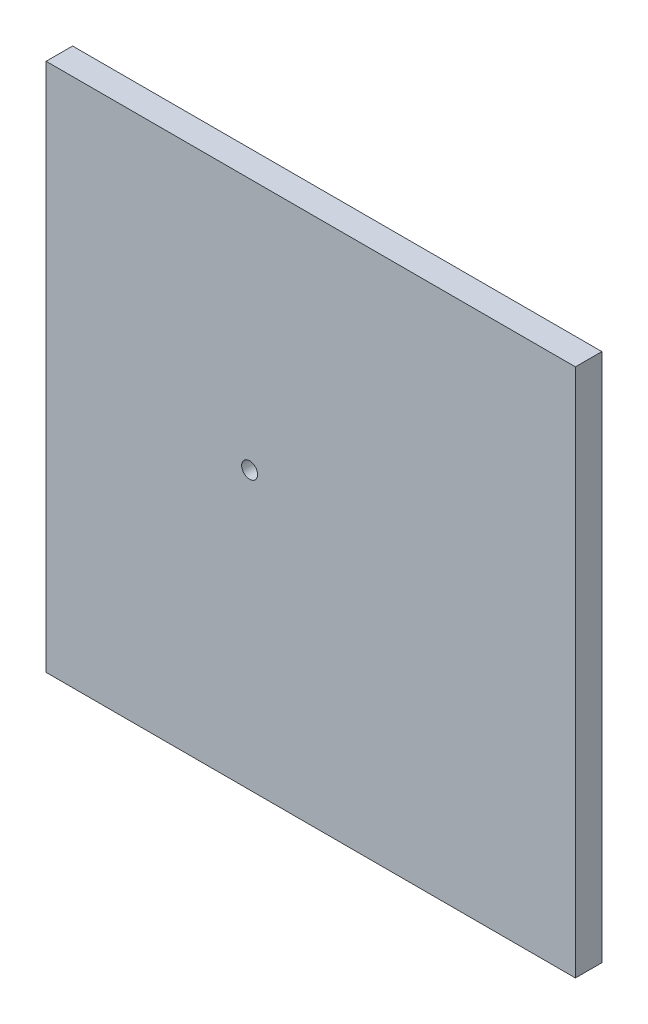
from build123d import *

# Parameters (mm, degrees)
SKETCH1_W           = 254
SKETCH1_H           = 254
BOSS_EXTRUDE1_DEPTH = 12.7
SKETCH2_R           = 3.827319808
CUT_EXTRUDE1_DEPTH  = 181.05357536


with BuildPart() as part:
    # Sketch1 → Boss-Extrude1 (new body)
    with BuildSketch(Plane.XY):
        Rectangle(SKETCH1_W, SKETCH1_H)
    extrude(amount=BOSS_EXTRUDE1_DEPTH)

    # Sketch2 → Cut-Extrude1 (cut, through all)
    with BuildSketch(Plane.XY.offset(12.7)):
        with Locations((-29.342785197, 5.953608591)):
            Circle(SKETCH2_R)
    extrude(amount=-CUT_EXTRUDE1_DEPTH, mode=Mode.SUBTRACT)


solid = part.part
